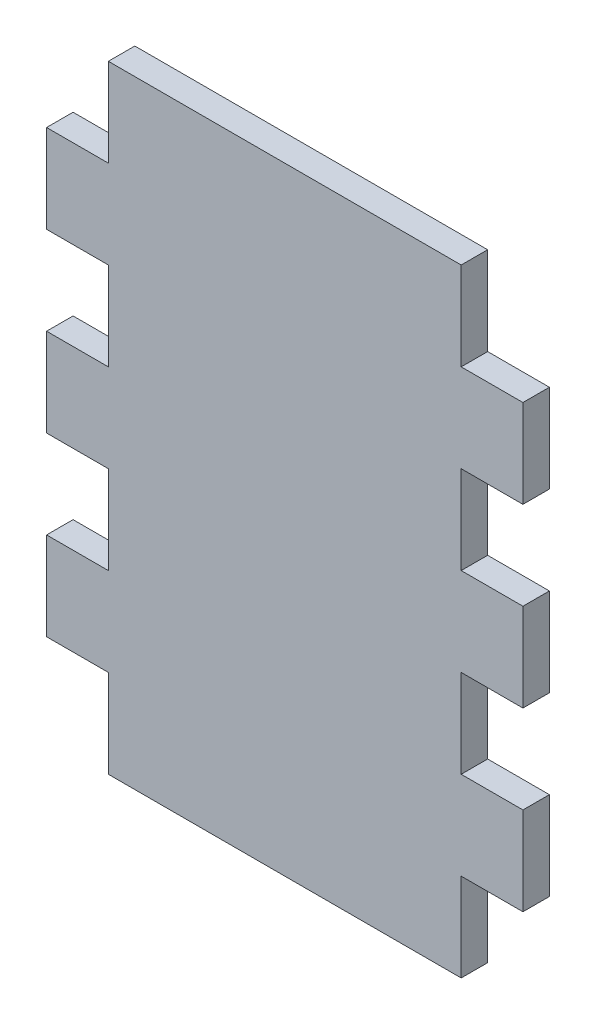
from build123d import *

# Parameters (mm, degrees)
ESBO_O1_W                = 7
ESBO_O1_H                = 10
RESSALTO_EXTRUS_O1_DEPTH = 3


with BuildPart() as part:
    # Esboço1 → Ressalto-extrusão1 (new body)
    with BuildSketch(Plane.XY):
        with Locations((-23.5, 0)):
            Rectangle(ESBO_O1_W, ESBO_O1_H)
        with Locations((-23.5, -20)):
            Rectangle(ESBO_O1_W, ESBO_O1_H)
        with Locations((23.5, 20)):
            Rectangle(ESBO_O1_W, ESBO_O1_H)
        with Locations((23.5, 0)):
            Rectangle(ESBO_O1_W, ESBO_O1_H)
        with Locations((23.5, -20)):
            Rectangle(ESBO_O1_W, ESBO_O1_H)
        Polygon((0, -35), (0, 35), (-20, 35), (-20, 25), (-20, 15), (-20, 5), (-20, -5), (-20, -15), (-20, -25), (-20, -35), align=None)
        Polygon((20, 35), (0, 35), (0, -35), (20, -35), (20, -25), (20, -15), (20, -5), (20, 5), (20, 15), (20, 25), align=None)
        with Locations((-23.5, 20)):
            Rectangle(ESBO_O1_W, ESBO_O1_H)
    extrude(amount=RESSALTO_EXTRUS_O1_DEPTH)


solid = part.part
